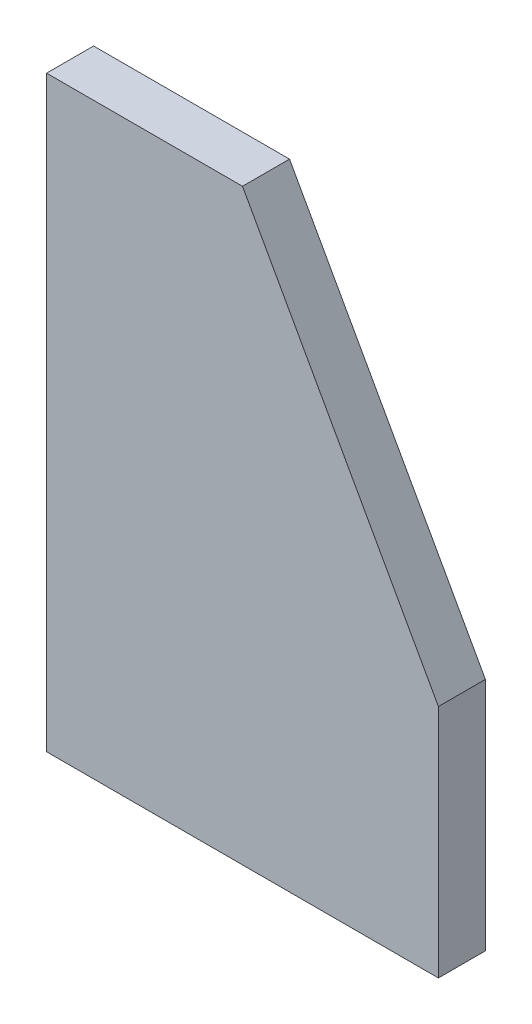
from build123d import *

# Parameters (mm, degrees)
BOSS_EXTRUDE1_DEPTH = 3


with BuildPart() as part:
    # Sketch1 → Boss-Extrude1 (new, symmetric)
    with BuildSketch(Plane.XY):
        Polygon((0, 37.5), (25, -7.5), (25, -37.5), (-25, -37.5), (-25, 37.5), align=None)
    extrude(amount=BOSS_EXTRUDE1_DEPTH, both=True)


solid = part.part
